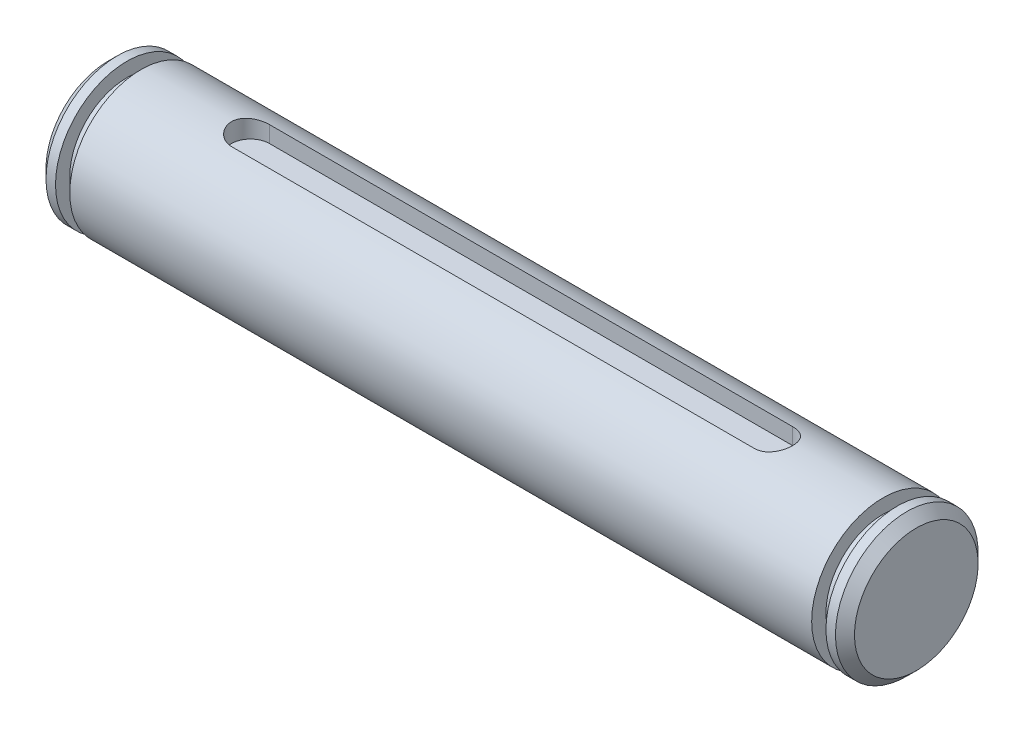
from build123d import *

# Parameters (mm, degrees)
CHAMFER1_SIZE      = 1
SKETCH3_W          = 4
SKETCH3_H          = 4
CUT_EXTRUDE1_DEPTH = 10
CUT_EXTRUDE2_DEPTH = 10


with BuildPart() as part:
    # Sketch1 → Revolve1 (revolve)
    with BuildSketch(Plane.XY, mode=Mode.PRIVATE) as revolve1_sk:
        Polygon((-42.5, 0), (-42.5, 7.5), (-40.5, 7.5), (-40.5, 6), (-39, 6), (-39, 7.5), (39, 7.5), (39, 6), (40.5, 6), (40.5, 7.5), (42.5, 7.5), (42.5, 0), align=None)
    revolve(revolve1_sk.sketch.rotate(Axis((-47.151991765, 0, 0), (1, 0, 0)), 90), axis=Axis((-47.151991765, 0, 0), (1, 0, 0)))

    # Chamfer1
    chamfer1_edges = [part.edges().sort_by_distance(p)[0] for p in [
        (42.5, 0, -7.5),
        (-42.5, 0, -7.5),
    ]]
    chamfer(chamfer1_edges, length=CHAMFER1_SIZE)

    # Sketch3 → Cut-Extrude1 (cut)
    with BuildSketch(Plane(origin=(0, 0, 0), x_dir=(0, 0, -1), z_dir=(1, 0, 0))):
        with Locations((0, 7.5)):
            Rectangle(SKETCH3_W, SKETCH3_H)
    extrude(amount=-CUT_EXTRUDE1_DEPTH, mode=Mode.SUBTRACT)

    # Sketch4 → Cut-Extrude2 (cut)
    with BuildSketch(Plane(origin=(0, 5.5, 0), x_dir=(1, 0, 0), z_dir=(0, 1, 0))):
        with BuildLine():
            Line((27.5, -2), (-27.5, -2))
            ThreePointArc((-27.5, -2), (-29.5, 0), (-27.5, 2))
            Line((-27.5, 2), (27.5, 2))
            ThreePointArc((27.5, 2), (29.5, 0), (27.5, -2))
        make_face()
    extrude(amount=CUT_EXTRUDE2_DEPTH, mode=Mode.SUBTRACT)


solid = part.part
